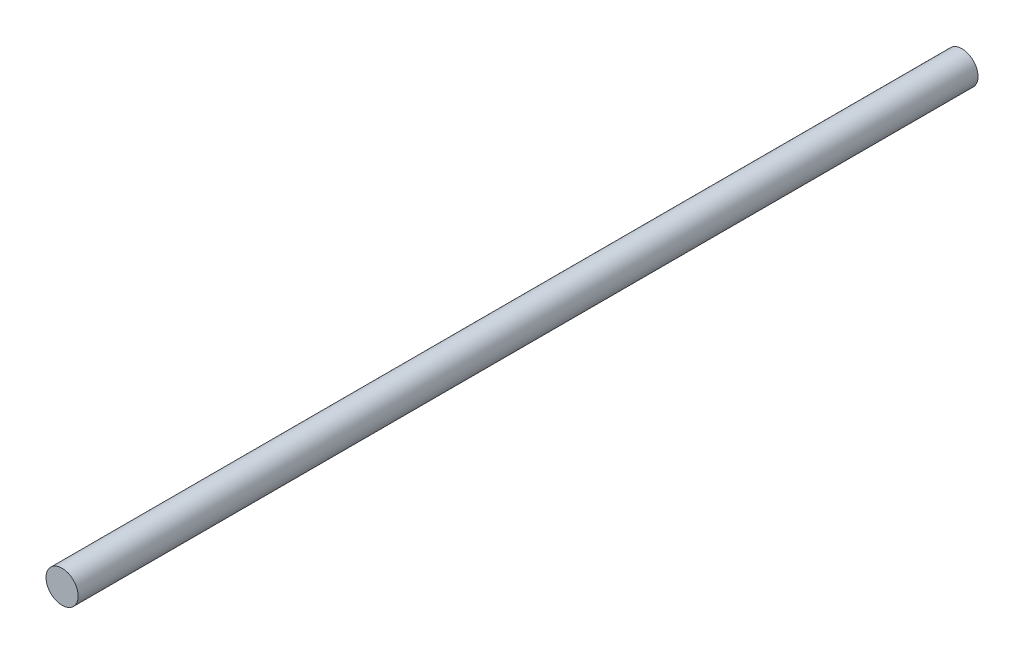
from build123d import *

# Parameters (mm, degrees)
SKETCH1_R           = 5
BOSS_EXTRUDE1_DEPTH = 280


with BuildPart() as part:
    # Sketch1 → Boss-Extrude1 (new body)
    with BuildSketch(Plane.XY):
        with Locations(Location((0, 0, 0), (0, 0, 180))):
            Circle(SKETCH1_R)
    extrude(amount=BOSS_EXTRUDE1_DEPTH)


solid = part.part
